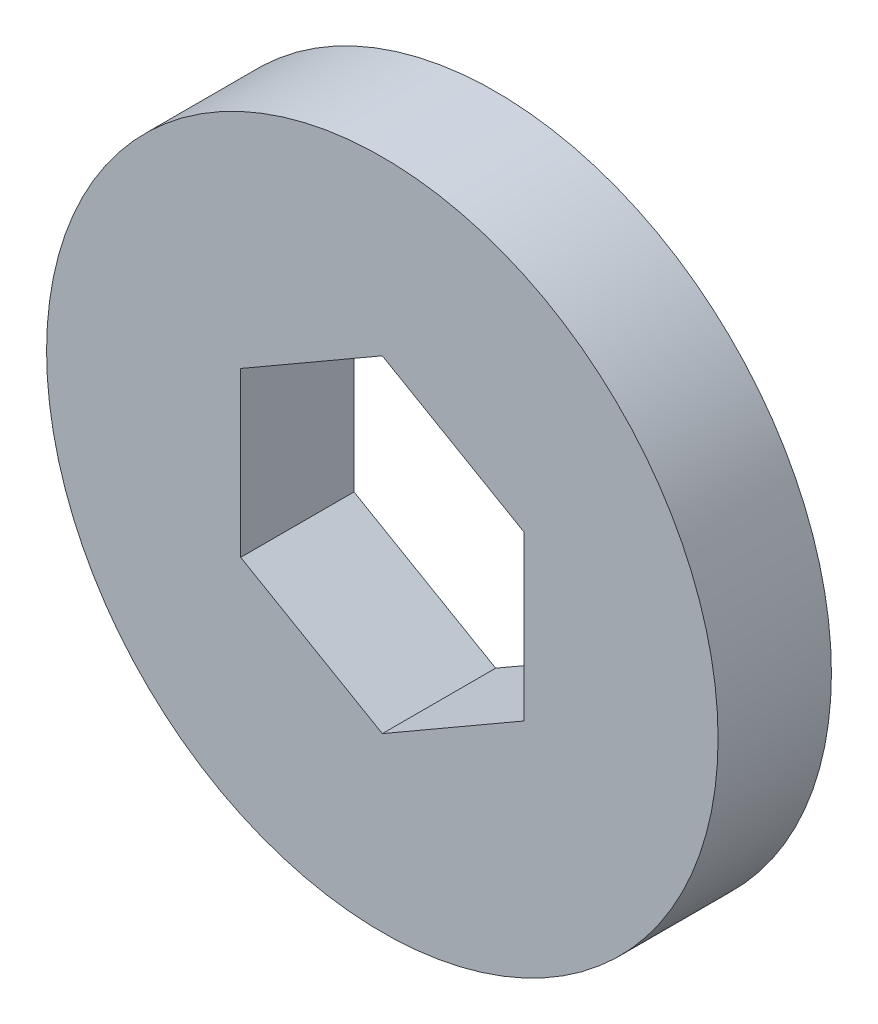
from build123d import *

# Parameters (mm, degrees)
SKETCH1_R           = 11.85
BOSS_EXTRUDE1_DEPTH = 4
CUT_EXTRUDE1_DEPTH  = 18.229190347
SCALE1_SCALE        = 0.4


with BuildPart() as part:
    # Sketch1 → Boss-Extrude1 (new body)
    with BuildSketch(Plane.XY):
        Circle(SKETCH1_R)
    extrude(amount=BOSS_EXTRUDE1_DEPTH)

    # Sketch2 → Cut-Extrude1 (cut, through all)
    with BuildSketch(Plane(origin=(0, 0, 0), x_dir=(-1, 0, 0), z_dir=(0, 0, -1))):
        Polygon((0, 5.773502692), (-5, 2.886751346), (-5, -2.886751346), (0, -5.773502692), (5, -2.886751346), (5, 2.886751346), align=None)
    extrude(amount=-CUT_EXTRUDE1_DEPTH, mode=Mode.SUBTRACT)


with BuildPart() as part_1:
    # Scale1: scaled about (0, 0, 2)
    add(part.part.scale(SCALE1_SCALE).moved(Location((0, 0, 1.2))))


solid = part_1.part
